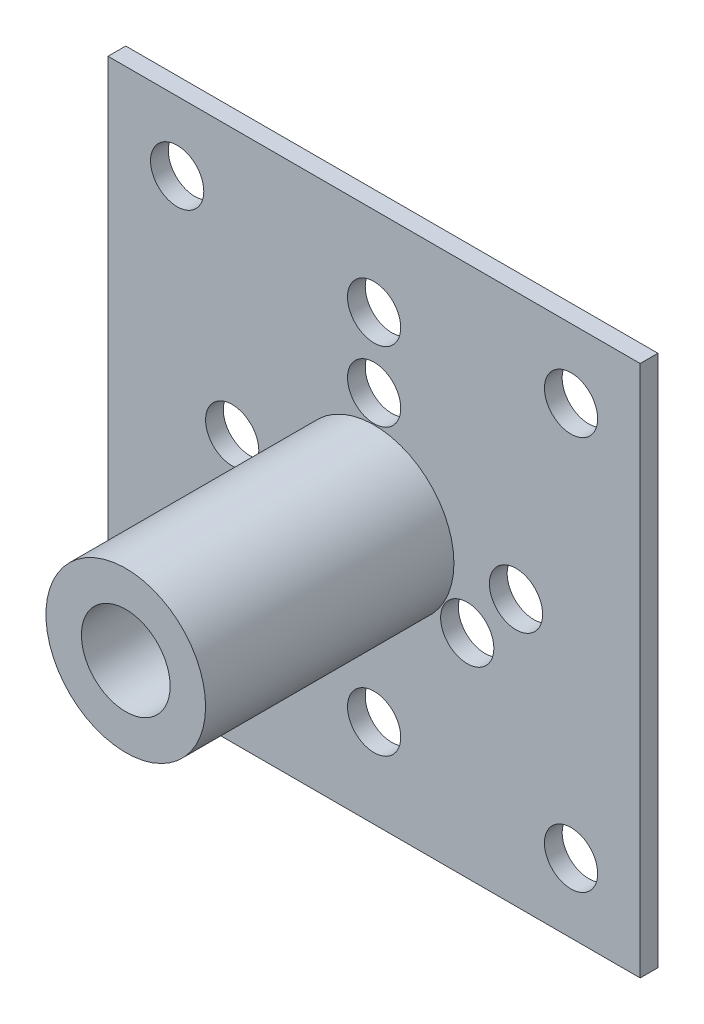
from build123d import *

# Parameters (mm, degrees)
SKETCH2_R           = 4.5
SKETCH2_R_2         = 2.5
BOSS_EXTRUDE4_DEPTH = 15
SKETCH3_W           = 30
SKETCH3_H           = 30
BOSS_EXTRUDE5_DEPTH = 1
SKETCH6_R           = 1.5
SKETCH6_R_2         = 2.5
CUT_EXTRUDE4_DEPTH  = 20


with BuildPart() as part:
    # Sketch2 → Boss-Extrude4 (new body)
    with BuildSketch(Plane.XY):
        Circle(SKETCH2_R)
        Circle(SKETCH2_R_2, mode=Mode.SUBTRACT)
    extrude(amount=BOSS_EXTRUDE4_DEPTH)

    # Sketch3 → Boss-Extrude5 (add)
    with BuildSketch(Plane.XY):
        Rectangle(SKETCH3_W, SKETCH3_H)
    extrude(amount=BOSS_EXTRUDE5_DEPTH)

    # Sketch6 → Cut-Extrude4 (cut)
    with BuildSketch(Plane.XY):
        with Locations((-11.101576465, -11.101576465)):
            Circle(SKETCH6_R)
        with Locations(Location((11.101576465, -11.101576465, 0), (0, 0, 180))):
            Circle(SKETCH6_R)
        with Locations((11.101576465, 11.101576465)):
            Circle(SKETCH6_R)
        with Locations(Location((-11.101576465, 11.101576465, 0), (0, 0, 180))):
            Circle(SKETCH6_R)
        with Locations((0, -10)):
            Circle(SKETCH6_R)
        with Locations(Location((0, 10, 0), (0, 0, 180))):
            Circle(SKETCH6_R)
        with Locations((-8, 0)):
            Circle(SKETCH6_R)
        with Locations(Location((8, 0, 0), (0, 0, 180))):
            Circle(SKETCH6_R)
        with Locations((0, 6.062177826)):
            Circle(SKETCH6_R)
        with Locations((5.25, -3.031088913)):
            Circle(SKETCH6_R)
        with Locations((-5.25, -3.031088913)):
            Circle(SKETCH6_R)
        Circle(SKETCH6_R_2)
    extrude(amount=CUT_EXTRUDE4_DEPTH, mode=Mode.SUBTRACT)


solid = part.part
